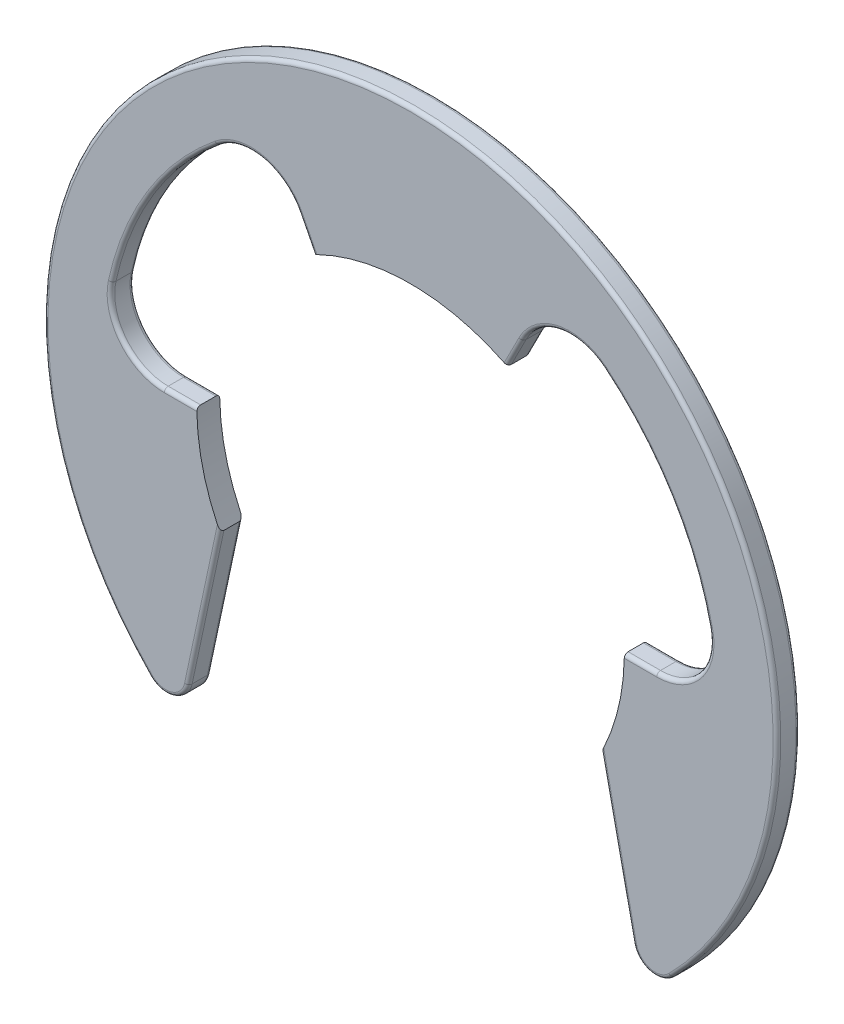
from build123d import *

# Parameters (mm, degrees)
BOSS_EXTRUDE1_DEPTH = 0.15
FILLET1_R           = 0.025
FILLET2_R           = 0.025


with BuildPart() as part:
    # Sketch1 → Boss-Extrude1 (new body)
    with BuildSketch(Plane.XY):
        with BuildLine():
            Line((-1.4, 0), (-1.61245155, 0))
            ThreePointArc((-1.61245155, 0), (-1.88492618, 0.13032393), (-1.954486727, 0.424242424))
            ThreePointArc((-1.954486727, 0.424242424), (-1.705280329, 1.044997129), (-1.265321174, 1.548858395))
            ThreePointArc((-1.265321174, 1.548858395), (-0.97185805, 1.620315698), (-0.732037685, 1.436704851))
            Line((-0.732037685, 1.436704851), (-0.6355867, 1.247409134))
            ThreePointArc((-0.6355867, 1.247409134), (0, 1.4), (0.6355867, 1.247409134))
            Line((0.6355867, 1.247409134), (0.732037685, 1.436704851))
            ThreePointArc((0.732037685, 1.436704851), (0.97185805, 1.620315698), (1.265321174, 1.548858395))
            ThreePointArc((1.265321174, 1.548858395), (1.705280329, 1.044997129), (1.954486727, 0.424242424))
            ThreePointArc((1.954486727, 0.424242424), (1.88492618, 0.13032393), (1.61245155, 0))
            Line((1.61245155, 0), (1.4, 0))
            ThreePointArc((1.4, 0), (1.361317889, -0.326823509), (1.247409134, -0.6355867))
            Line((1.247409134, -0.6355867), (1.455652054, -1.610875335))
            ThreePointArc((1.455652054, -1.610875335), (1.560324773, -1.723547455), (1.709168439, -1.684857041))
            ThreePointArc((1.709168439, -1.684857041), (0, 2.4), (-1.709168439, -1.684857041))
            ThreePointArc((-1.709168439, -1.684857041), (-1.560324773, -1.723547455), (-1.455652054, -1.610875335))
            Line((-1.455652054, -1.610875335), (-1.247409134, -0.6355867))
            ThreePointArc((-1.247409134, -0.6355867), (-1.361317889, -0.326823509), (-1.4, 0))
        make_face()
    extrude(amount=BOSS_EXTRUDE1_DEPTH)

    # Fillet1
    fillet1_edges = [part.edges().sort_by_distance(p)[0] for p in [
        (1.560324773, -1.723547455, 0.15),
        (0, 2.4, 0.15),
        (-1.560324773, -1.723547455, 0.15),
        (-1.351530594, -1.123231017, 0.15),
        (1.351530594, -1.123231017, 0.15),
    ]]
    fillet(fillet1_edges, radius=FILLET1_R)

    # Fillet2
    fillet2_edges = [part.edges().sort_by_distance(p)[0] for p in [
        (1.506225775, 0, 0),
        (1.88492618, 0.13032393, 0),
        (1.705280329, 1.044997129, 0),
        (0.97185805, 1.620315698, 0),
        (0.683812192, 1.342056992, 0),
        (-0.683812192, 1.342056992, 0),
        (-0.97185805, 1.620315698, 0),
        (-1.705280329, 1.044997129, 0),
        (-1.88492618, 0.13032393, 0),
        (-1.506225775, 0, 0),
        (-1.351530594, -1.123231017, 0),
        (-1.560324773, -1.723547455, 0),
        (0, 2.4, 0),
        (1.560324773, -1.723547455, 0),
        (1.351530594, -1.123231017, 0),
        (-1.506225775, 0, 0.15),
        (-1.88492618, 0.13032393, 0.15),
        (-1.705280329, 1.044997129, 0.15),
        (-0.97185805, 1.620315698, 0.15),
        (-0.683812192, 1.342056992, 0.15),
        (0.683812192, 1.342056992, 0.15),
        (0.97185805, 1.620315698, 0.15),
        (1.705280329, 1.044997129, 0.15),
        (1.88492618, 0.13032393, 0.15),
        (1.506225775, 0, 0.15),
    ]]
    fillet(fillet2_edges, radius=FILLET2_R)


solid = part.part
